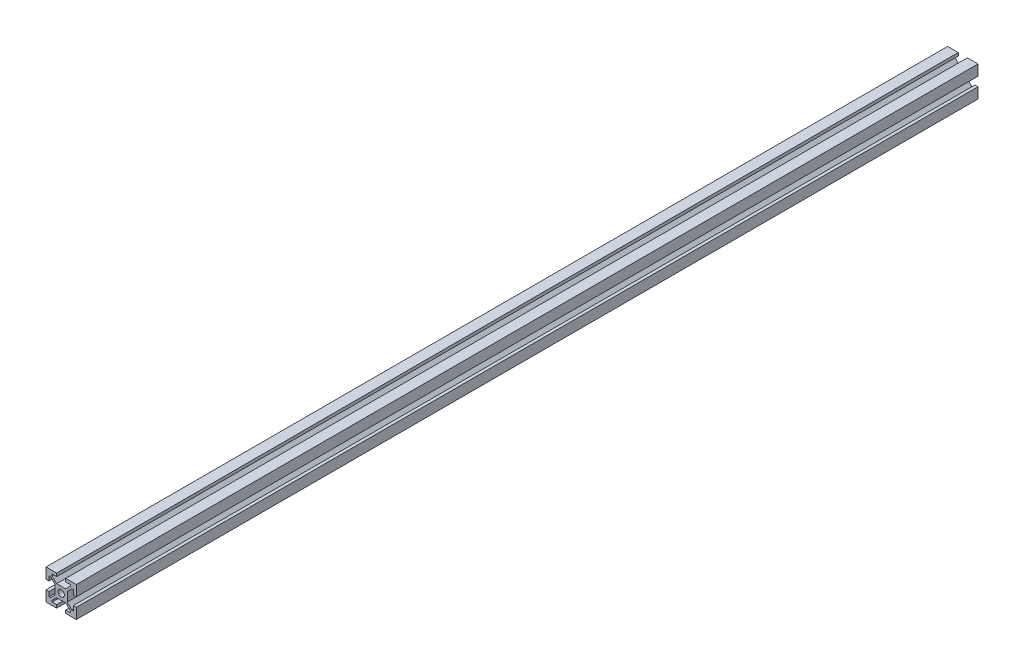
from build123d import *

# Parameters (mm, degrees)
SKETCH_2_R      = 2.1
EXTRUDE_1_DEPTH = 594


with BuildPart() as part:
    # ｽｹｯﾁ2 → ﾎﾞｽ - 押し出し1 (new body)
    with BuildSketch(Plane.XY):
        Polygon((3, 4), (-3, 4), (-6, 7), (-6, 8), (-3, 8), (-3, 10), (-10, 10), (-10, 3), (-8, 3), (-8, 6), (-7, 6), (-4, 3), (-4, -3), (-7, -6), (-8, -6), (-8, -3), (-10, -3), (-10, -10), (-3, -10), (-3, -8), (-6, -8), (-6, -7), (-3, -4), (3, -4), (6, -7), (6, -8), (3, -8), (3, -10), (10, -10), (10, -3), (8, -3), (8, -6), (7, -6), (4, -3), (4, 3), (7, 6), (8, 6), (8, 3), (10, 3), (10, 10), (3, 10), (3, 8), (6, 8), (6, 7), align=None)
        Circle(SKETCH_2_R, mode=Mode.SUBTRACT)
    extrude(amount=EXTRUDE_1_DEPTH)


solid = part.part
